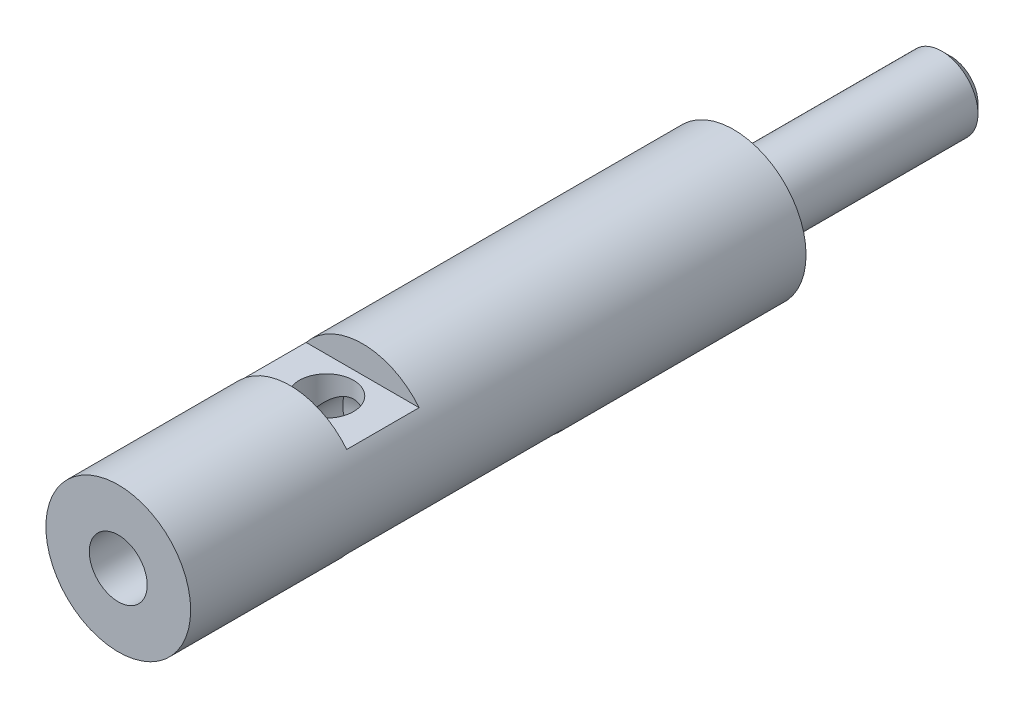
from build123d import *

# Parameters (mm, degrees)
SKETCH1_R                      = 4
BOSS_EXTRUDE1_DEPTH            = 34
SKETCH2_R                      = 2
BOSS_EXTRUDE2_DEPTH            = 12
CHAMFER1_SIZE                  = 0.5
F_3_2_3_2_DIAMETER_HOLE1_D     = 3.2
F_3_2_3_2_DIAMETER_HOLE1_DEPTH = 14
F_3_2_3_2_DIAMETER_HOLE1_TIP   = 0.96137699
CUT_EXTRUDE2_DEPTH             = 47.346520905
CUT_EXTRUDE2_DEPTH_BACK        = 47.346520905
SKETCH5_W                      = 12
SKETCH5_H                      = 1.5
SKETCH5_W_2                    = 4
F_3_0_3_DIAMETER_HOLE1_REACH   = 48.629
F_3_0_3_DIAMETER_HOLE1_BORE_R  = 1.5


with BuildPart() as part:
    # Sketch1 → Boss-Extrude1 (new body)
    with BuildSketch(Plane.XY):
        Circle(SKETCH1_R)
    extrude(amount=-BOSS_EXTRUDE1_DEPTH)

    # Sketch2 → Boss-Extrude2 (add)
    with BuildSketch(Plane(origin=(0, 0, -34), x_dir=(-1, 0, 0), z_dir=(0, 0, -1))):
        Circle(SKETCH2_R)
    extrude(amount=BOSS_EXTRUDE2_DEPTH)

    # Chamfer1
    chamfer1_edges = [part.edges().sort_by_distance(p)[0] for p in [
        (2, 0, -46),
    ]]
    chamfer(chamfer1_edges, length=CHAMFER1_SIZE)

    # Ø3.2 (3.2) Diameter Hole1
    with Locations(Plane.XY):
        with Locations((0, 0)):
            Hole(F_3_2_3_2_DIAMETER_HOLE1_D / 2, depth=F_3_2_3_2_DIAMETER_HOLE1_DEPTH)
            with Locations((0, 0, -(F_3_2_3_2_DIAMETER_HOLE1_DEPTH + F_3_2_3_2_DIAMETER_HOLE1_TIP / 2))):  # 118° drill point
                Cone(0, F_3_2_3_2_DIAMETER_HOLE1_D / 2, F_3_2_3_2_DIAMETER_HOLE1_TIP, mode=Mode.SUBTRACT)

    # Sketch5 → Cut-Extrude2 (cut, two sides: drawn at the far end of the back side and taken through both)
    with BuildSketch(Plane(origin=(0, 0, 0), x_dir=(0, 0, -1), z_dir=(1, 0, 0)).offset(-CUT_EXTRUDE2_DEPTH_BACK)):
        with Locations((15.5, -3.25)):
            Rectangle(SKETCH5_W, SKETCH5_H)
        with Locations((11.5, 3.25)):
            Rectangle(SKETCH5_W_2, SKETCH5_H)
    extrude(amount=CUT_EXTRUDE2_DEPTH + CUT_EXTRUDE2_DEPTH_BACK, mode=Mode.SUBTRACT)

    # Ø3.0 (3) Diameter Hole1 bore → Ø3.0 (3) Diameter Hole1 (cut, up to next)
    with BuildSketch(Plane(origin=(0, 2.5, 0), x_dir=(1, 0, 0), z_dir=(0, 1, 0)), mode=Mode.PRIVATE) as f_3_0_3_diameter_hole1_sk1:
        with Locations((0, 11.5)):
            Circle(F_3_0_3_DIAMETER_HOLE1_BORE_R)
    f_3_0_3_diameter_hole1_tool1 = extrude(f_3_0_3_diameter_hole1_sk1.sketch, amount=-F_3_0_3_DIAMETER_HOLE1_REACH, mode=Mode.PRIVATE) & part.part
    add(f_3_0_3_diameter_hole1_tool1.solids().sort_by_distance((0, 2.5, -11.5))[0], mode=Mode.SUBTRACT)


solid = part.part
